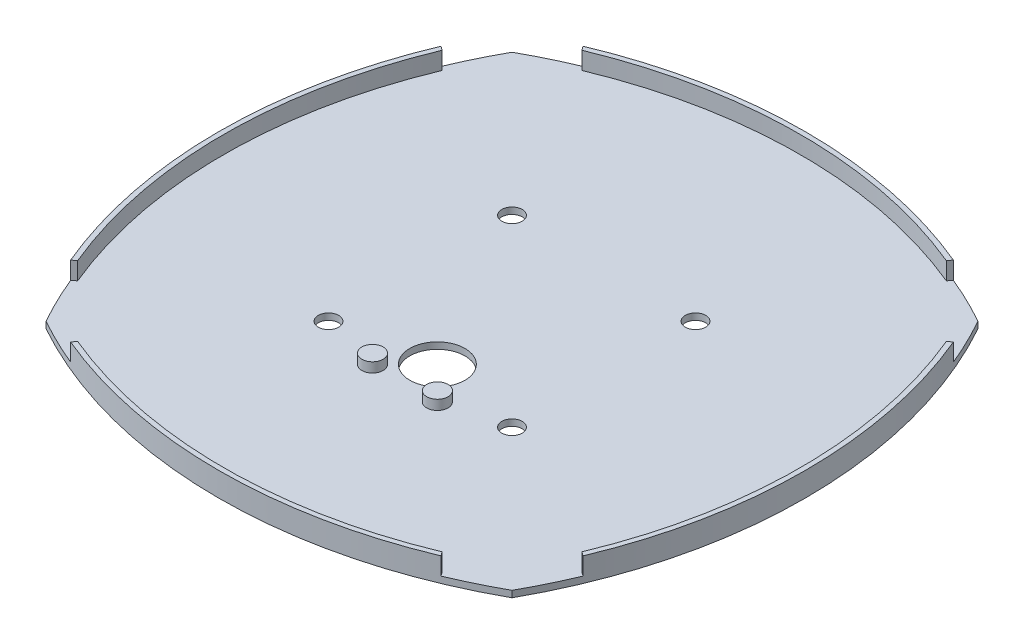
from build123d import *

# Parameters (mm, degrees)
BOSS_EXTRUDE1_DEPTH     = 2
BOSS_EXTRUDE2_DEPTH     = 5.4
CUT_EXTRUDE2_DEPTH      = 324.312541101
CUT_EXTRUDE2_DEPTH_BACK = 324.312541101
SKETCH11_R              = 3.15
SKETCH11_R_2            = 8.5
SKETCH13_R              = 3.289472506
BOSS_EXTRUDE3_DEPTH     = 3


with BuildPart() as part:
    # Sketch3 → Boss-Extrude1 (new body)
    with BuildSketch(Plane(origin=(0, 0, 0), x_dir=(1, 0, 0), z_dir=(0, 1, 0))):
        with BuildLine():
            ThreePointArc((271.153533245, 18.921159404), (199.331937646, 37.525228411), (127.510342047, 18.921159404))
            ThreePointArc((127.510342047, 18.921159404), (108.90627304, -52.900436194), (127.510342047, -124.722031793))
            ThreePointArc((127.510342047, -124.722031793), (199.331937646, -143.3261008), (271.153533245, -124.722031793))
            ThreePointArc((271.153533245, -124.722031793), (289.757602252, -52.900436194), (271.153533245, 18.921159404))
        make_face()
    extrude(amount=BOSS_EXTRUDE1_DEPTH)

    # Sketch5 → Boss-Extrude2 (add)
    with BuildSketch(Plane(origin=(0, 2, 0), x_dir=(1, 0, 0), z_dir=(0, 1, 0))):
        with BuildLine():
            Line((121.611565862, -109.080289564), (120.36423024, -109.98653194))
            ThreePointArc((120.36423024, -109.98653194), (108.906273045, -52.899217103), (120.365171108, 4.187908885))
            Line((120.365171108, 4.187908885), (121.612501818, 3.281670078))
            ThreePointArc((121.612501818, 3.281670078), (110.406273045, -52.899216401), (121.611565862, -109.080289564))
        make_face()
        with BuildLine():
            Line((143.152084277, -130.620807978), (142.2458419, -131.8681436))
            ThreePointArc((142.2458419, -131.8681436), (199.331937646, -143.3261008), (256.418033392, -131.8681436))
            Line((256.418033392, -131.8681436), (255.511791015, -130.620807978))
            ThreePointArc((255.511791015, -130.620807978), (199.331937646, -141.8261008), (143.152084277, -130.620807978))
        make_face()
        with BuildLine():
            Line((277.052309429, 3.279417175), (278.299645052, 4.185659552))
            ThreePointArc((278.299645052, 4.185659552), (289.757602252, -52.900436194), (278.299645052, -109.98653194))
            Line((278.299645052, -109.98653194), (277.052309429, -109.080289564))
            ThreePointArc((277.052309429, -109.080289564), (288.257602252, -52.900436194), (277.052309429, 3.279417175))
        make_face()
        with BuildLine():
            Line((255.511791015, 24.819935589), (256.418033392, 26.067271212))
            ThreePointArc((256.418033392, 26.067271212), (199.330718555, 37.525228406), (142.243592567, 26.066330343))
            Line((142.243592567, 26.066330343), (143.149831374, 24.818999633))
            ThreePointArc((143.149831374, 24.818999633), (199.330717853, 36.025228406), (255.511791015, 24.819935589))
        make_face()
    extrude(amount=BOSS_EXTRUDE2_DEPTH)

    # Sketch11 → Cut-Extrude2 (cut, two sides: drawn at the far end of the back side and taken through both)
    with BuildSketch(Plane(origin=(0, 2, 0), x_dir=(1, 0, 0), z_dir=(0, 1, 0)).offset(-CUT_EXTRUDE2_DEPTH_BACK)):
        with Locations(Location((171.047666398, -24.616164947, 0), (0, 0, 270))):
            Circle(SKETCH11_R)
        with Locations(Location((227.616208893, -24.616164947, 0), (0, 0, 270))):
            Circle(SKETCH11_R)
        with Locations(Location((227.616208893, -81.184707442, 0), (0, 0, 270))):
            Circle(SKETCH11_R)
        with Locations(Location((171.047666398, -81.184707442, 0), (0, 0, 270))):
            Circle(SKETCH11_R)
        with Locations(Location((199.331937646, -75.900436194, 0), (0, 0, 270))):
            Circle(SKETCH11_R_2)
    extrude(amount=CUT_EXTRUDE2_DEPTH + CUT_EXTRUDE2_DEPTH_BACK, mode=Mode.SUBTRACT)

    # Sketch13 → Boss-Extrude3 (add)
    with BuildSketch(Plane(origin=(0, 2, 0), x_dir=(1, 0, 0), z_dir=(0, 1, 0))):
        with Locations(Location((189.331937646, -85.900436194, 0), (0, 0, 270))):
            Circle(SKETCH13_R)
        with Locations(Location((209.331937646, -85.900436194, 0), (0, 0, 270))):
            Circle(SKETCH13_R)
    extrude(amount=BOSS_EXTRUDE3_DEPTH)


solid = part.part
